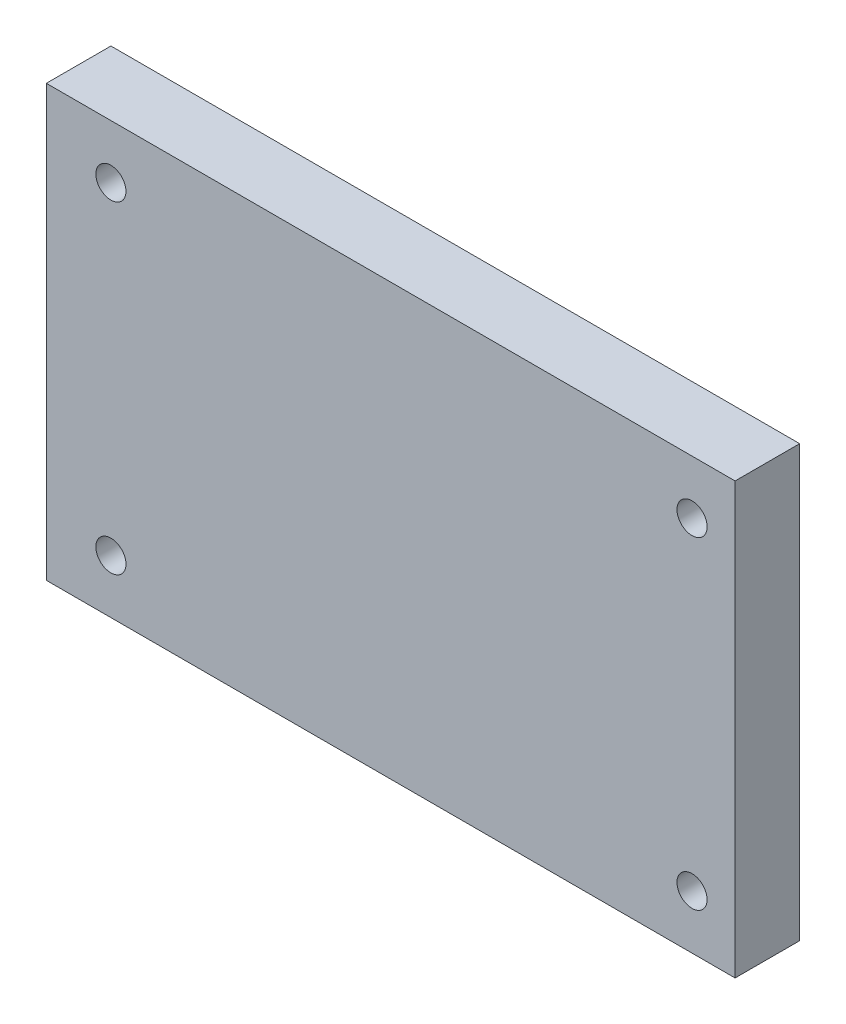
from build123d import *

# Parameters (mm, degrees)
ESQUISSE1_W             = 32
ESQUISSE1_H             = 20
BOSS_EXTRU_1_DEPTH      = 3
ESQUISSE2_R             = 0.7
ENL_V_MAT_EXTRU_1_DEPTH = 20.104973175


with BuildPart() as part:
    # Esquisse1 → Boss.-Extru.1 (new body)
    with BuildSketch(Plane.XY):
        Rectangle(ESQUISSE1_W, ESQUISSE1_H)
    extrude(amount=BOSS_EXTRU_1_DEPTH)

    # Esquisse2 → Enlèv. mat.-Extru.1 (cut, through all)
    with BuildSketch(Plane.XY.offset(3)):
        with Locations((-13, 7.5)):
            Circle(ESQUISSE2_R)
        with Locations(Location((14, 7.5, 0), (0, 0, 180))):
            Circle(ESQUISSE2_R)
        with Locations((14, -7.5)):
            Circle(ESQUISSE2_R)
        with Locations(Location((-13, -7.5, 0), (0, 0, 180))):
            Circle(ESQUISSE2_R)
    extrude(amount=-ENL_V_MAT_EXTRU_1_DEPTH, mode=Mode.SUBTRACT)


solid = part.part
